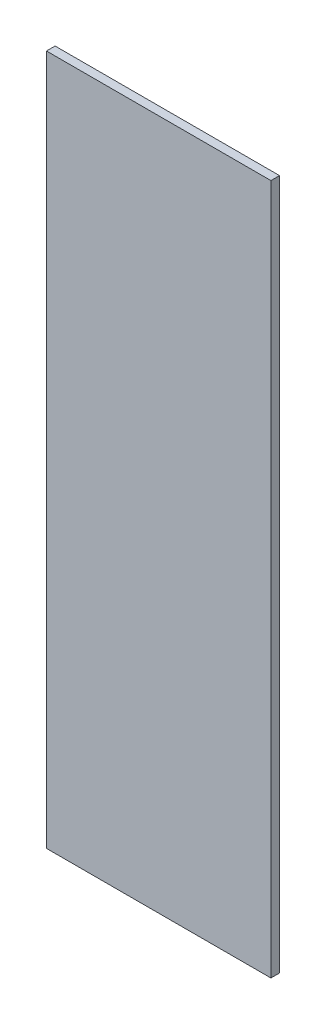
from build123d import *

# Parameters (mm, degrees)
ESQUISSE1_W        = 130
ESQUISSE1_H        = 400
BOSS_EXTRU_1_DEPTH = 5


with BuildPart() as part:
    # Esquisse1 → Boss.-Extru.1 (new body)
    with BuildSketch(Plane.XY):
        Rectangle(ESQUISSE1_W, ESQUISSE1_H)
    extrude(amount=BOSS_EXTRU_1_DEPTH)


solid = part.part
